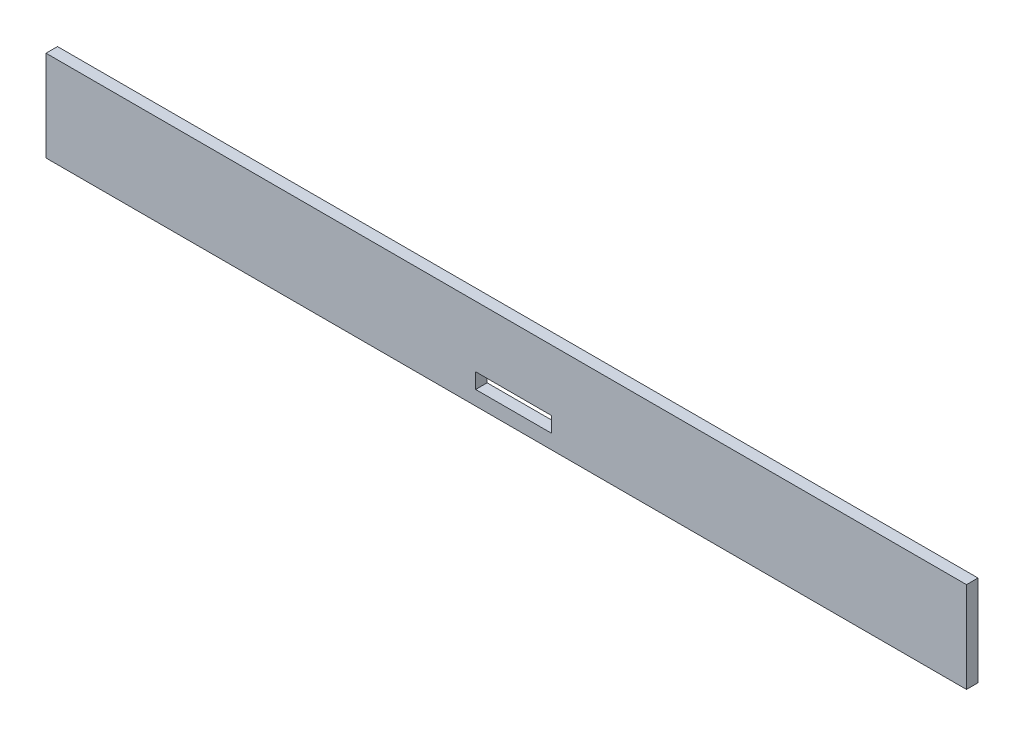
from build123d import *

# Parameters (mm, degrees)
SKETCH1_W           = 203.2
SKETCH1_H           = 20.0406
SKETCH1_W_2         = 16.764
SKETCH1_H_2         = 3.386666667
BOSS_EXTRUDE1_DEPTH = 2.54


with BuildPart() as part:
    # Sketch1 → Boss-Extrude1 (new body)
    with BuildSketch(Plane.XY):
        with Locations((101.6, 10.0203)):
            Rectangle(SKETCH1_W, SKETCH1_H)
        with Locations((103.22852928, 4.868333334)):
            Rectangle(SKETCH1_W_2, SKETCH1_H_2, mode=Mode.SUBTRACT)
    extrude(amount=BOSS_EXTRUDE1_DEPTH)


solid = part.part
